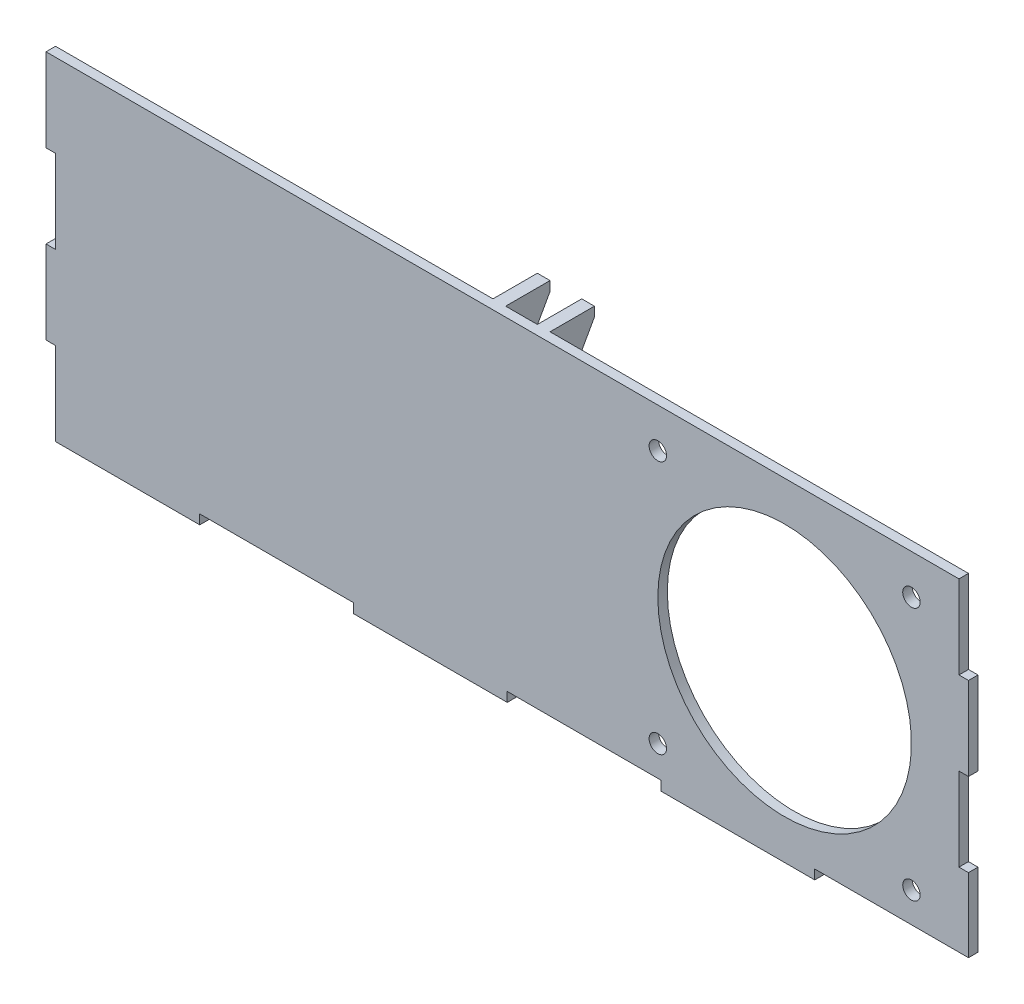
from build123d import *

# Parameters (mm, degrees)
SKETCH_1_W          = 291
SKETCH_1_H          = 105
EXTRUDE_1_DEPTH     = 3
SKETCH_2_W          = 3
SKETCH_2_H          = 26.25
SKETCH_2_W_2        = 48.5
SKETCH_2_H_2        = 3
CUT_EXTRUDE_1_DEPTH = 3
SKETCH_3_R          = 40
SKETCH_3_R_2        = 2.75
CUT_EXTRUDE_2_DEPTH = 3
SKETCH_4_W          = 4
SKETCH_4_H          = 28
EXTRUDE_2_DEPTH     = 14
CUT_EXTRUDE_3_REACH = 167.192


with BuildPart() as part:
    # Эскиз1 → Бобышка-Вытянуть1 (new body)
    with BuildSketch(Plane.XY):
        Rectangle(SKETCH_1_W, SKETCH_1_H)
    extrude(amount=EXTRUDE_1_DEPTH)

    # Эскиз2 → Вырез-Вытянуть1 (cut)
    with BuildSketch(Plane.XY.offset(3)):
        with Locations((-144, -39.375)):
            Rectangle(SKETCH_2_W, SKETCH_2_H)
        with Locations((-144, 13.125)):
            Rectangle(SKETCH_2_W, SKETCH_2_H)
        with Locations((-72.75, -51)):
            Rectangle(SKETCH_2_W_2, SKETCH_2_H_2)
        with Locations((24.25, -51)):
            Rectangle(SKETCH_2_W_2, SKETCH_2_H_2)
        with Locations((121.25, -51)):
            Rectangle(SKETCH_2_W_2, SKETCH_2_H_2)
        with Locations((144, 39.375)):
            Rectangle(SKETCH_2_W, SKETCH_2_H)
        with Locations((144, -13.125)):
            Rectangle(SKETCH_2_W, SKETCH_2_H)
    extrude(amount=-CUT_EXTRUDE_1_DEPTH, mode=Mode.SUBTRACT)

    # Эскиз3 → Вырез-Вытянуть2 (cut)
    with BuildSketch(Plane(origin=(0, 0, 0), x_dir=(-1, 0, 0), z_dir=(0, 0, -1))):
        with Locations((-87.5, 0)):
            Circle(SKETCH_3_R)
        with Locations((-127.5, 40)):
            Circle(SKETCH_3_R_2)
        with Locations((-47.5, 40)):
            Circle(SKETCH_3_R_2)
        with Locations((-47.5, -40)):
            Circle(SKETCH_3_R_2)
        with Locations((-127.5, -40)):
            Circle(SKETCH_3_R_2)
    extrude(amount=-CUT_EXTRUDE_2_DEPTH, mode=Mode.SUBTRACT)

    # Эскиз4 → Бобышка-Вытянуть2 (add)
    with BuildSketch(Plane(origin=(0, 0, 0), x_dir=(-1, 0, 0), z_dir=(0, 0, -1))):
        with Locations((5.5, 38.5)):
            Rectangle(SKETCH_4_W, SKETCH_4_H)
        with Locations((-8.5, 38.5)):
            Rectangle(SKETCH_4_W, SKETCH_4_H)
    extrude(amount=EXTRUDE_2_DEPTH)

    # Вырез-Вытянуть3: up to this face of the body (flat: up to its plane)
    cut_extrude_3_end = Plane(part.part.faces().sort_by_distance((-7.5, 38.5, -7))[0])
    # Эскиз5 → Вырез-Вытянуть3 (cut, up to the picked face)
    with BuildSketch(Plane(origin=(10.5, 0, 0), x_dir=(0, 0, -1), z_dir=(1, 0, 0)), mode=Mode.PRIVATE) as cut_extrude_3_sk1:
        Polygon((0, 24.5), (14, 24.5), (14, 49.5), align=None)
    cut_extrude_3_tool1 = split(extrude(cut_extrude_3_sk1.sketch, amount=-CUT_EXTRUDE_3_REACH, mode=Mode.PRIVATE), bisect_by=cut_extrude_3_end, keep=Keep.BOTH, mode=Mode.PRIVATE)
    add(cut_extrude_3_tool1.solids().sort_by(Axis((10.5, 32.833333, -9.333333), (-1, 0, 0)))[0], mode=Mode.SUBTRACT)


solid = part.part
